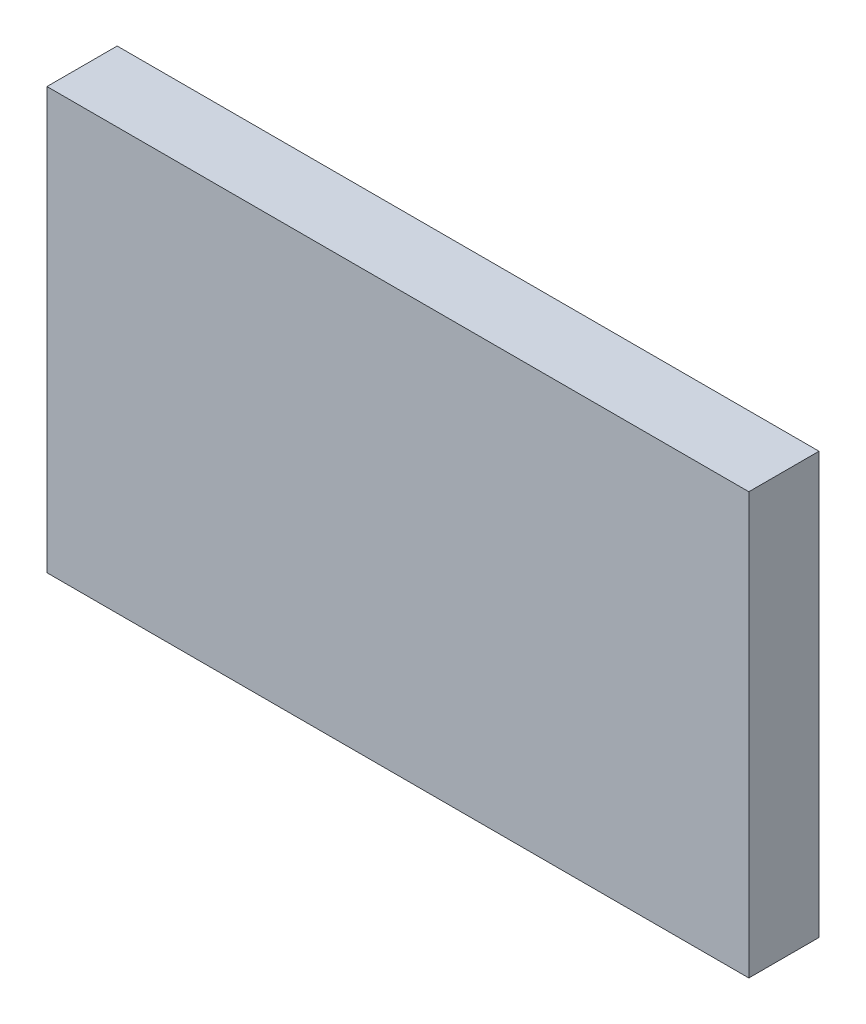
from build123d import *

# Parameters (mm, degrees)
SKETCH_1_W      = 100000
SKETCH_1_H      = 60000
EXTRUDE_1_DEPTH = 10000


with BuildPart() as part:
    # 草图1 → 凸台-拉伸1 (new body)
    with BuildSketch(Plane.XY):
        with Locations((50000, 30000)):
            Rectangle(SKETCH_1_W, SKETCH_1_H)
    extrude(amount=-EXTRUDE_1_DEPTH)


solid = part.part
